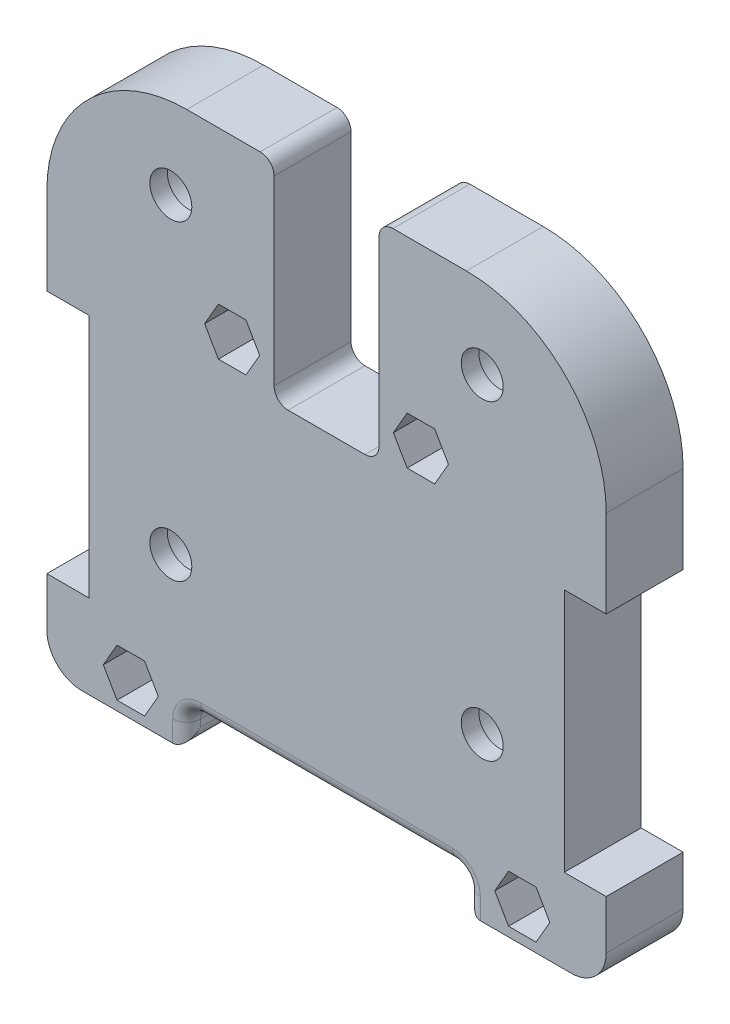
from build123d import *

# Parameters (mm, degrees)
SKETCH_1_W                   = 80
SKETCH_1_H                   = 100
EXTRUDE_1_DEPTH              = 11
SKETCH_7_W                   = 15
SKETCH_7_H                   = 30
CUT_EXTRUDE_1_DEPTH          = 16
HOLE_WIZARD_M4_1_D           = 3.3
HOLE_WIZARD_M4_1_CSINK_D     = 4.05
HOLE_WIZARD_M4_1_CSINK_ANGLE = 90
FILLET_1_R                   = 20
FILLET_2_R                   = 2
SKETCH_9_W                   = 6
SKETCH_9_H                   = 35
CUT_EXTRUDE_2_DEPTH          = 11
SKETCH_11_R                  = 3
CUT_EXTRUDE_4_DEPTH          = 15
SKETCH_15_R                  = 1.9
CUT_EXTRUDE_8_DEPTH          = 14
SKETCH_16_R                  = 4.52
CUT_EXTRUDE_9_DEPTH          = 8.5
CUT_EXTRUDE_10_DEPTH         = 8.5
CUT_EXTRUDE_11_DEPTH         = 13.5
FILLET_4_R                   = 5
FILLET_5_R                   = 2


with BuildPart() as part:
    # 草图1 → 凸台-拉伸1 (new body)
    with BuildSketch(Plane.XY):
        Rectangle(SKETCH_1_W, SKETCH_1_H)
    extrude(amount=EXTRUDE_1_DEPTH)

    # 草图7 → 切除-拉伸1 (cut)
    with BuildSketch(Plane.XY.offset(11)):
        with Locations((0, 35)):
            Rectangle(SKETCH_7_W, SKETCH_7_H)
    extrude(amount=-CUT_EXTRUDE_1_DEPTH, mode=Mode.SUBTRACT)

    # M4 螺纹孔1 (through all)
    with Locations(Plane(origin=(13.5, 24.75, 0), x_dir=(-1, 0, 0), z_dir=(0, 0, -1))):
        with Locations((0, 0), (27, 0), (41.5, -49.5), (-14.5, -49.5)):
            CounterSinkHole(HOLE_WIZARD_M4_1_D / 2, HOLE_WIZARD_M4_1_CSINK_D / 2, counter_sink_angle=HOLE_WIZARD_M4_1_CSINK_ANGLE)

    # 圆角1
    fillet_1_edges = [part.edges().sort_by_distance(p)[0] for p in [
        (-40, 50, 5.5),
        (40, 50, 5.5),
    ]]
    fillet(fillet_1_edges, radius=FILLET_1_R)

    # 圆角2
    fillet_2_edges = [part.edges().sort_by_distance(p)[0] for p in [
        (-7.5, 20, 5.5),
        (-7.5, 50, 5.5),
        (7.5, 50, 5.5),
        (7.5, 20, 5.5),
        (40, -50, 5.5),
        (-40, -50, 5.5),
    ]]
    fillet(fillet_2_edges, radius=FILLET_2_R)

    # 草图9 → 切除-拉伸2 (cut)
    with BuildSketch(Plane.XY):
        with Locations((37, 0)):
            Rectangle(SKETCH_9_W, SKETCH_9_H)
        with Locations((-37, 0)):
            Rectangle(SKETCH_9_W, SKETCH_9_H)
    extrude(amount=CUT_EXTRUDE_2_DEPTH, mode=Mode.SUBTRACT)

    # 草图11 → 切除-拉伸4 (cut)
    with BuildSketch(Plane.XY):
        with Locations((-22.273863607, 38.273863607)):
            Circle(SKETCH_11_R)
        with Locations((22.273863607, 38.273863607)):
            Circle(SKETCH_11_R)
        with Locations((22.273863607, -6.273863607)):
            Circle(SKETCH_11_R)
        with Locations((-22.273863607, -6.273863607)):
            Circle(SKETCH_11_R)
    extrude(amount=CUT_EXTRUDE_4_DEPTH, mode=Mode.SUBTRACT)

    # 草图15 → 切除-拉伸8 (cut)
    with BuildSketch(Plane.XY.offset(11)):
        with Locations((-13.5, 24.75)):
            Circle(SKETCH_15_R)
        with Locations((-28, -24.75)):
            Circle(SKETCH_15_R)
        with Locations(Location((13.5, 24.75, 0), (0, 0, 180))):
            Circle(SKETCH_15_R)
        with Locations(Location((28, -24.75, 0), (0, 0, 180))):
            Circle(SKETCH_15_R)
    extrude(amount=-CUT_EXTRUDE_8_DEPTH, mode=Mode.SUBTRACT)

    # 草图16 → 切除-拉伸9 (cut)
    with BuildSketch(Plane(origin=(0, 0, 0), x_dir=(-1, 0, 0), z_dir=(0, 0, -1))):
        with Locations((-22.273863607, 38.273863607)):
            Circle(SKETCH_16_R)
        with Locations((-22.273863607, -6.273863607)):
            Circle(SKETCH_16_R)
        with Locations(Location((22.273863607, -6.273863607, 0), (0, 0, 180))):
            Circle(SKETCH_16_R)
        with Locations(Location((22.273863607, 38.273863607, 0), (0, 0, 180))):
            Circle(SKETCH_16_R)
    extrude(amount=-CUT_EXTRUDE_9_DEPTH, mode=Mode.SUBTRACT)

    # 草图17 → 切除-拉伸10 (cut)
    with BuildSketch(Plane.XY.offset(11)):
        Polygon((-15.468764418, 21.34), (-11.531235582, 21.34), (-9.562471164, 24.75), (-11.531235582, 28.16), (-15.468764418, 28.16), (-17.437528836, 24.75), align=None)
        Polygon((-26.031235582, -28.16), (-24.062471164, -24.75), (-26.031235582, -21.34), (-29.968764418, -21.34), (-31.937528836, -24.75), (-29.968764418, -28.16), align=None)
        Polygon((29.968764418, -28.16), (26.031235582, -28.16), (24.062471164, -24.75), (26.031235582, -21.34), (29.968764418, -21.34), (31.937528836, -24.75), align=None)
        Polygon((17.437528836, 24.75), (15.468764418, 21.34), (11.531235582, 21.34), (9.562471164, 24.75), (11.531235582, 28.16), (15.468764418, 28.16), align=None)
    extrude(amount=-CUT_EXTRUDE_10_DEPTH, mode=Mode.SUBTRACT)

    # 草图18 → 切除-拉伸11 (cut)
    with BuildSketch(Plane.XY.offset(11)):
        Polygon((-52.225177231, -29.5), (-20, -29.5), (-20, -24.5), (20, -24.5), (20, -29.5), (49.13660357, -29.5), (49.13660357, -55.082609568), (-52.225177231, -55.082609568), align=None)
    extrude(amount=-CUT_EXTRUDE_11_DEPTH, mode=Mode.SUBTRACT)

    # 圆角4
    fillet_4_edges = [part.edges().sort_by_distance(p)[0] for p in [
        (40, -29.5, 5.5),
        (-40, -29.5, 5.5),
    ]]
    fillet(fillet_4_edges, radius=FILLET_4_R)

    # 圆角5
    fillet_5_edges = [part.edges().sort_by_distance(p)[0] for p in [
        (-20, -27, 0),
        (-20, -29.5, 5.5),
        (0, -24.5, 0),
        (-20, -24.5, 5.5),
        (20, -27, 0),
        (20, -24.5, 5.5),
        (20, -29.5, 5.5),
        (20, -27, 11),
        (0, -24.5, 11),
        (-20, -27, 11),
    ]]
    fillet(fillet_5_edges, radius=FILLET_5_R)


solid = part.part
